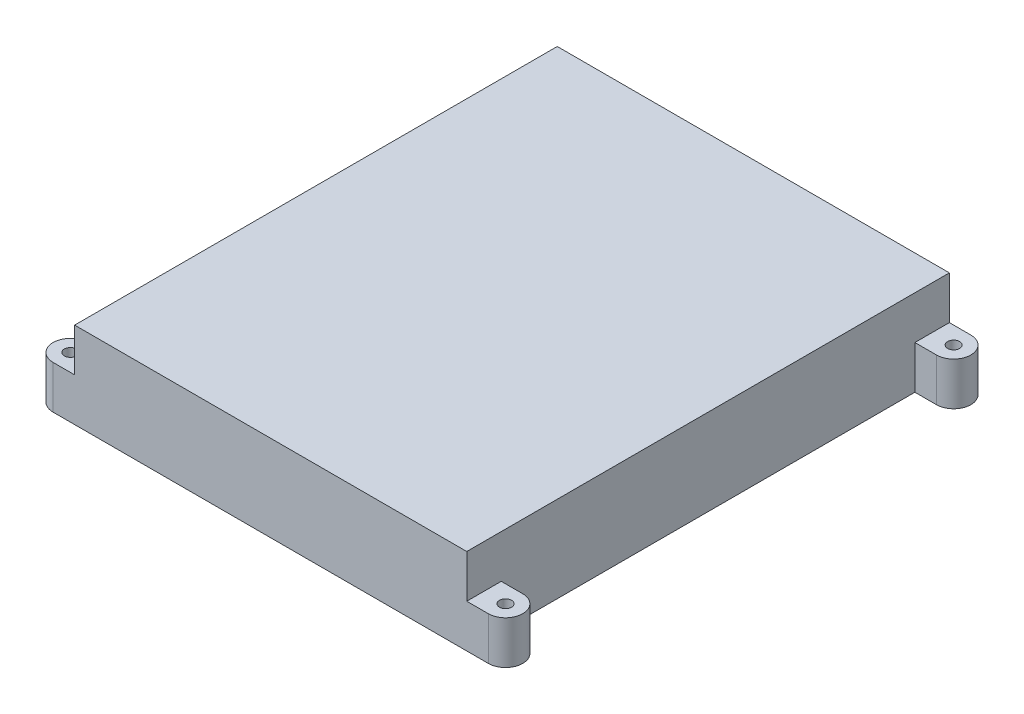
from build123d import *

# Parameters (mm, degrees)
SKETCH1_W                            = 91
SKETCH1_H                            = 112
BASE_DEPTH                           = 20
SKETCH2_R                            = 1.4
CASE_ASSEMBLY_HOLES_DEPTH            = 10
SKETCH3_W                            = 83
SKETCH3_H                            = 104
MODULE_CUTOUT_DEPTH                  = 6.6
USB_C_AND_MICRO_USB_SLOTS_DEPTH      = 117.344316578
USB_C_AND_MICRO_USB_SLOTS_DEPTH_BACK = 7
SKETCH4_W                            = 10.5
SKETCH4_H                            = 6
SKETCH4_W_2                          = 10
SKETCH5_W                            = 16.5
SKETCH5_H                            = 10
SKETCH5_W_2                          = 16
SKETCH5_H_2                          = 19
HDMI_AND_USB_SLOTS_DEPTH             = 17.5
SKETCH6_W                            = 17.9
SKETCH6_H                            = 16.2
ETHERNET_SLOT_DEPTH                  = 21
SKETCH7_R                            = 3.6
SKETCH7_W                            = 24
SKETCH7_H                            = 5
TALL_COMPONENTS_CUTOUTS_DEPTH        = 3


with BuildPart() as part:
    # Sketch1 → Base (new body)
    with BuildSketch(Plane(origin=(0, 0, 0), x_dir=(1, 0, 0), z_dir=(0, 1, 0))):
        Rectangle(SKETCH1_W, SKETCH1_H)
    extrude(amount=BASE_DEPTH)

    # Sketch2 → Case Assembly Holes (add)
    # profile 1 of 4: a face of its own
    with BuildSketch(Plane(origin=(0, 0, 0), x_dir=(1, 0, 0), z_dir=(0, 1, 0))):
        with BuildLine():
            Line((-45.5, 56), (-50.5, 56))
            ThreePointArc((-50.5, 56), (-54.5, 52), (-50.5, 48))
            Line((-50.5, 48), (-45.5, 48))
            Line((-45.5, 48), (-45.5, 56))
        make_face()
        with Locations(Location((-50.5, 52, 0), (0, 0, 270))):
            Circle(SKETCH2_R, mode=Mode.SUBTRACT)
    # profile 2 of 4: a face of its own
    with BuildSketch(Plane(origin=(0, 0, 0), x_dir=(1, 0, 0), z_dir=(0, 1, 0))):
        with BuildLine():
            Line((45.5, 48), (50.5, 48))
            ThreePointArc((50.5, 48), (54.5, 52), (50.5, 56))
            Line((50.5, 56), (45.5, 56))
            Line((45.5, 56), (45.5, 48))
        make_face()
        with Locations(Location((50.5, 52, 0), (0, 0, 90))):
            Circle(SKETCH2_R, mode=Mode.SUBTRACT)
    # profile 3 of 4: a face of its own
    with BuildSketch(Plane(origin=(0, 0, 0), x_dir=(1, 0, 0), z_dir=(0, 1, 0))):
        with BuildLine():
            Line((45.5, -56), (50.5, -56))
            ThreePointArc((50.5, -56), (54.5, -52), (50.5, -48))
            Line((50.5, -48), (45.5, -48))
            Line((45.5, -48), (45.5, -56))
        make_face()
        with Locations(Location((50.5, -52, 0), (0, 0, 270))):
            Circle(SKETCH2_R, mode=Mode.SUBTRACT)
    # profile 4 of 4: a face of its own
    with BuildSketch(Plane(origin=(0, 0, 0), x_dir=(1, 0, 0), z_dir=(0, 1, 0))):
        with BuildLine():
            Line((-45.5, -48), (-50.5, -48))
            ThreePointArc((-50.5, -48), (-54.5, -52), (-50.5, -56))
            Line((-50.5, -56), (-45.5, -56))
            Line((-45.5, -56), (-45.5, -48))
        make_face()
        with Locations(Location((-50.5, -52, 0), (0, 0, 90))):
            Circle(SKETCH2_R, mode=Mode.SUBTRACT)
    extrude(amount=CASE_ASSEMBLY_HOLES_DEPTH)

    # Sketch3 → Module Cutout (cut)
    with BuildSketch(Plane.XZ):
        Rectangle(SKETCH3_W, SKETCH3_H)
    extrude(amount=-MODULE_CUTOUT_DEPTH, mode=Mode.SUBTRACT)

    # Sketch4 → USB-C and Micro-USB Slots (cut, two sides: drawn at the far end of the back side and taken through both)
    with BuildSketch(Plane.ZY.offset(45.5).offset(-USB_C_AND_MICRO_USB_SLOTS_DEPTH_BACK)):
        with Locations((-44, 3)):
            Rectangle(SKETCH4_W, SKETCH4_H)
        with Locations((42, 3)):
            Rectangle(SKETCH4_W_2, SKETCH4_H)
    extrude(amount=USB_C_AND_MICRO_USB_SLOTS_DEPTH + USB_C_AND_MICRO_USB_SLOTS_DEPTH_BACK, mode=Mode.SUBTRACT)

    # Sketch5 → HDMI and USB Slots (cut)
    with BuildSketch(Plane.ZY.offset(45.5)):
        with Locations((-26.25, 5)):
            Rectangle(SKETCH5_W, SKETCH5_H)
        with Locations((-7.4, 9.5)):
            Rectangle(SKETCH5_W_2, SKETCH5_H_2)
        with Locations((9.6, 9.5)):
            Rectangle(SKETCH5_W_2, SKETCH5_H_2)
    extrude(amount=-HDMI_AND_USB_SLOTS_DEPTH, mode=Mode.SUBTRACT)

    # Sketch6 → Ethernet Slot (cut)
    with BuildSketch(Plane.ZY.offset(45.5)):
        with Locations((26.55, 8.1)):
            Rectangle(SKETCH6_W, SKETCH6_H)
    extrude(amount=-ETHERNET_SLOT_DEPTH, mode=Mode.SUBTRACT)

    # Sketch7 → Tall Components Cutouts (cut)
    with BuildSketch(Plane.XZ.offset(-6.6)):
        with Locations(Location((-20.05, -12.75, 0), (0, 0, 270))):
            Circle(SKETCH7_R)
        with Locations(Location((-15.25, 32.09, 0), (0, 0, 270))):
            Circle(SKETCH7_R)
        with Locations((6.5, -46.25)):
            Rectangle(SKETCH7_W, SKETCH7_H)
    extrude(amount=-TALL_COMPONENTS_CUTOUTS_DEPTH, mode=Mode.SUBTRACT)


solid = part.part
